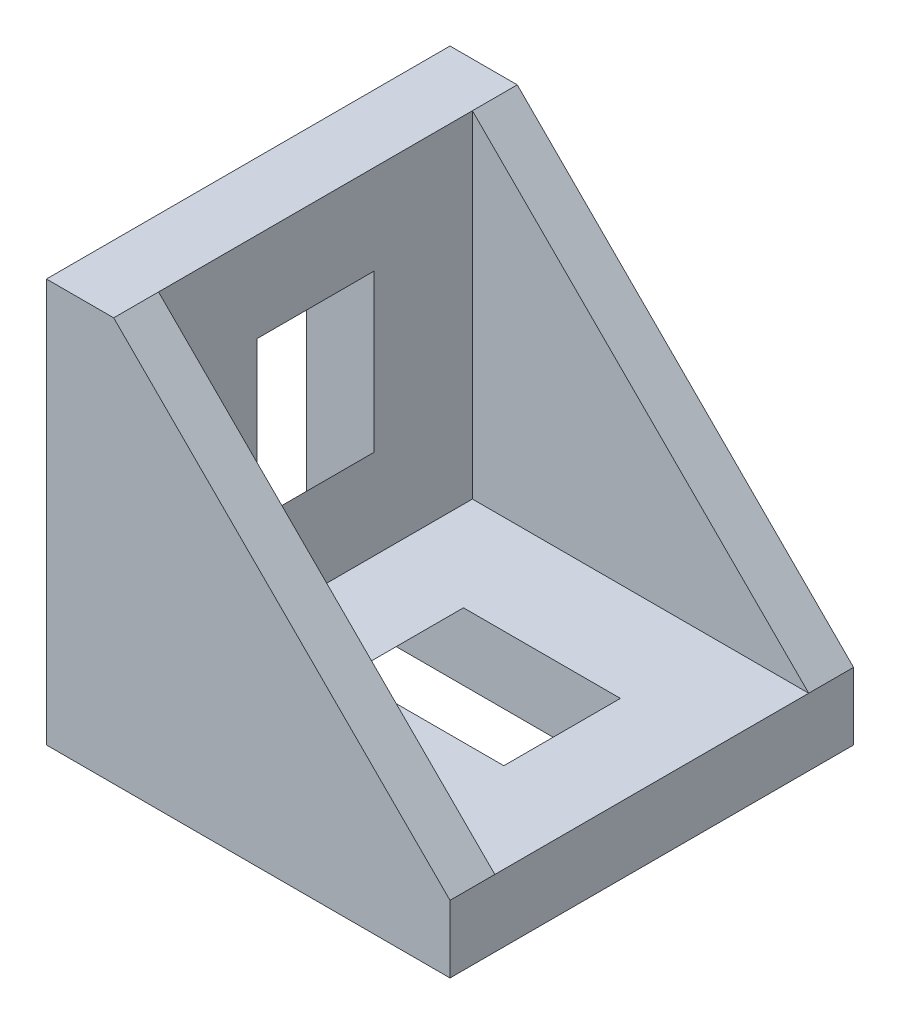
from build123d import *

# Parameters (mm, degrees)
BOSS_EXTRUDE1_DEPTH = 9
CUT_EXTRUDE1_DEPTH  = 7
CUT_EXTRUDE2_DEPTH  = 2.6
BOSS_EXTRUDE2_DEPTH = 3


with BuildPart() as part:
    # Sketch1 → Boss-Extrude1 (new, symmetric)
    with BuildSketch(Plane.XY):
        Polygon((0, 0), (0, 18), (3, 18), (18, 3), (18, 0), align=None)
    extrude(amount=BOSS_EXTRUDE1_DEPTH, both=True)

    # Sketch2 → Cut-Extrude1 (cut, symmetric)
    with BuildSketch(Plane.XY):
        Polygon((3, 18), (3, 3), (18, 3), align=None)
    extrude(amount=CUT_EXTRUDE1_DEPTH, both=True, mode=Mode.SUBTRACT)

    # Sketch3 → Cut-Extrude2 (cut, symmetric)
    with BuildSketch(Plane.XY):
        Polygon((0, 14), (3, 14), (3, 7), (0, 4), align=None)
        Polygon((7, 3), (14, 3), (14, 0), (4, 0), align=None)
    extrude(amount=CUT_EXTRUDE2_DEPTH, both=True, mode=Mode.SUBTRACT)

    # Sketch4 → Boss-Extrude2 (add, symmetric)
    with BuildSketch(Plane.XY):
        Polygon((1.504575227, -1.8), (0.511249685, -0.790946088), (1.234750477, 0), (3.535533906, 0), align=None)
        Polygon((0, 3.535533906), (-1.8, 1.504575227), (-0.790946088, 0.511249685), (0, 1.234750477), align=None)
        Polygon((0, 17.3), (0, 14.999216572), (-0.790946088, 14.275715779), (-1.8, 15.269041321), align=None)
        Polygon((14.999216572, 0), (14.275715779, -0.790946088), (15.269041321, -1.8), (17.3, 0), align=None)
    extrude(amount=BOSS_EXTRUDE2_DEPTH, both=True)


solid = part.part
